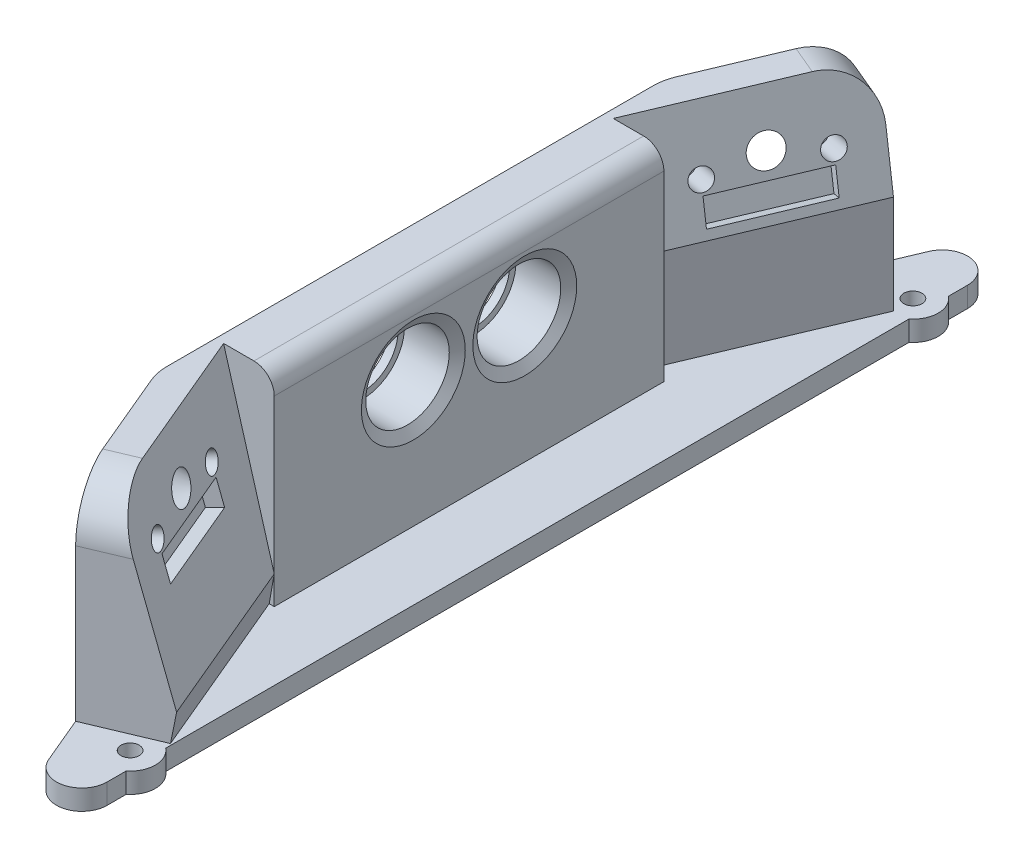
from build123d import *

# Parameters (mm, degrees)
SKETCH_4_R               = 1.7999999999999927
EXTRUDE_1_DEPTH          = 4
EXTRUDE_2_DEPTH          = 40
SKETCH_6_W               = 76.91060849654107
SKETCH_6_H               = 40
EXTRUDE_3_DEPTH          = 10
SKETCH_7_R               = 8.25
SKETCH_7_R_2             = 8.250000000000004
CUT_EXTRUDE_1_DEPTH      = 10
SKETCH_8_R               = 6.999999999999999
CUT_EXTRUDE_2_DEPTH      = 119.93776725632856
EXTRUDE_5_DEPTH          = 40
SKETCH_9_R               = 2.0000000000000115
SKETCH_9_R_2             = 2.00000000000001
CUT_EXTRUDE_3_DEPTH      = 7
CUT_EXTRUDE_5_DEPTH      = 146.2070616981638
CUT_EXTRUDE_5_DEPTH_BACK = 146.2070616981638
SKETCH_9_4_R             = 3.0000000000000018
CUT_EXTRUDE_6_DEPTH      = 2
DRAFT_2_ANGLE            = -30.000000000000068
CHAMFER_4_SIZE           = 2
CHAMFER_4_SIZE2          = 1.1547005383792546
EXTRUDE_7_DEPTH          = 40
FILLET_5_R               = 5
SKETCH_14_R              = 1.9999999999999967
CUT_EXTRUDE_8_DEPTH      = 7
SKETCH_14_7_R            = 2.9999999999999947
CUT_EXTRUDE_9_DEPTH      = 197.0223260158318
CUT_EXTRUDE_10_DEPTH     = 3
DRAFT_3_ANGLE            = -30.000000000000068
FILLET_6_R               = 10
FILLET_7_R               = 10
FILLET_8_R               = 4
EXTRUDE_START            = -4
SKETCH_15_R              = 5.000000000000005
SKETCH_15_R_2            = 1.7999999999999927
EXTRUDE_8_DEPTH          = 4


with BuildPart() as part:
    # Эскиз4 → Бобышка-Вытянуть1 (new body)
    with BuildSketch(Plane(origin=(0, 0, 0), x_dir=(1, 0, 0), z_dir=(0, 1, 0))):
        Polygon((-69.87376571346093, 109.67480643053035), (-95.00000000000003, 50), (-95.00000000000009, -50), (-69.87376571346097, -109.67480643053035), align=None)
        with Locations(Location((-73.00000000000004, 77.26, 0), (0, 0, 270))):
            Circle(SKETCH_4_R, mode=Mode.SUBTRACT)
        with Locations(Location((-73.0000000000001, -77.26, 0), (0, 0, 90))):
            Circle(SKETCH_4_R, mode=Mode.SUBTRACT)
    extrude(amount=EXTRUDE_1_DEPTH)

    # Эскиз5 → Бобышка-Вытянуть2 (add)
    with BuildSketch(Plane(origin=(0, 4, 0), x_dir=(1, 0, 0), z_dir=(0, 1, 0))):
        Polygon((-95.00000000000003, -50), (-95.00000000000003, 50), (-83.35828999825604, 77.64906125414197), (-77.82847774742764, 75.32071925379316), (-93.35075774975296, 38.45530424827052), (-93.35075774975294, -38.45530424827055), (-77.82847774742763, -75.32071925379319), (-83.35828999825621, -77.64906125414207), align=None)
    extrude(amount=EXTRUDE_2_DEPTH)

    # Эскиз6 → Бобышка-Вытянуть3 (add)
    with BuildSketch(Plane(origin=(-93.35075774975296, 0, 1.684e-14), x_dir=(-1.5e-16, 0, -1), z_dir=(1, 0, -1.5e-16))):
        with Locations((0, 24)):
            Rectangle(SKETCH_6_W, SKETCH_6_H)
    extrude(amount=EXTRUDE_3_DEPTH)

    # Эскиз7 → Вырез-Вытянуть1 (cut)
    with BuildSketch(Plane(origin=(-83.35075774975297, 0, 0), x_dir=(-2.9e-16, 0, -1), z_dir=(1, 0, -2.9e-16))):
        with Locations((-11, 28.999999999999996)):
            Circle(SKETCH_7_R)
        with Locations(Location((11, 28.999999999999996, 0), (0, 0, 180))):
            Circle(SKETCH_7_R_2)
    extrude(amount=-CUT_EXTRUDE_1_DEPTH, mode=Mode.SUBTRACT)

    # Эскиз8 → Вырез-Вытянуть2 (cut, through all)
    with BuildSketch(Plane(origin=(-83.35075774975297, 0, 0), x_dir=(-2.9e-16, 0, -1), z_dir=(1, 0, -2.9e-16))):
        with Locations((-11, 28.999999999999996)):
            Circle(SKETCH_8_R)
        with Locations((11, 28.999999999999996)):
            Circle(SKETCH_8_R)
    extrude(amount=-CUT_EXTRUDE_2_DEPTH, mode=Mode.SUBTRACT)

    # Эскиз11 → Бобышка-Вытянуть5 (add)
    with BuildSketch(Plane(origin=(15.21818058997927, 0, -36.143178901200706), x_dir=(-0.921635375138065, 0, -0.3880570000581333), z_dir=(0.3880570000581333, 0, -0.921635375138065))):
        Polygon((100.95821064102289, 44), (100.95821064102287, 4), (95.46066620957018, 4), (95.46066620957018, 23.48288486495062), align=None)
    extrude(amount=-EXTRUDE_5_DEPTH)

    # Эскиз9 → Вырез-Вытянуть3 (cut)
    with BuildSketch(Plane(origin=(-85.21572151642773, 1.219544691400093, -28.236570194978846), x_dir=(0.4235830207630388, -0.16773125949651355, -0.8901930403620174), z_dir=(0.8902314112674724, 0.2588190451025148, 0.3748342784284101))):
        with Locations(Location((12.376634231225777, 34.970039830268206, 0), (0, 0, 10))):
            Circle(SKETCH_9_R)
        with Locations(Location((32.07278929146997, 38.443003383606666, 0), (0, 0, 10))):
            Circle(SKETCH_9_R_2)
    extrude(amount=-CUT_EXTRUDE_3_DEPTH, mode=Mode.SUBTRACT)

    # Эскиз9<4> → Вырез-Вытянуть5 (cut, two sides: drawn at the far end of the back side and taken through both)
    with BuildSketch(Plane(origin=(-85.21572151642773, 1.219544691400093, -28.236570194978846), x_dir=(0.4235830207630388, -0.16773125949651355, -0.8901930403620174), z_dir=(0.8902314112674724, 0.2588190451025148, 0.3748342784284101)).offset(-CUT_EXTRUDE_5_DEPTH_BACK)):
        with Locations(Location((21.877415406014027, 38.67613711296185, 0), (0, 0, 10))):
            Circle(SKETCH_9_4_R)
    extrude(amount=CUT_EXTRUDE_5_DEPTH + CUT_EXTRUDE_5_DEPTH_BACK, mode=Mode.SUBTRACT)

    # Эскиз9<5> → Вырез-Вытянуть6 (cut)
    with BuildSketch(Plane(origin=(-85.21572151642773, 1.219544691400093, -28.236570194978846), x_dir=(0.4235830207630388, -0.16773125949651355, -0.8901930403620174), z_dir=(0.8902314112674724, 0.2588190451025148, 0.3748342784284101))):
        Polygon((32.50690973563728, 35.98098400107614), (33.37515062397189, 31.056945236015093), (13.678995563727707, 27.583981682676626), (12.810754675393087, 32.50802044773767), align=None)
    extrude(amount=-CUT_EXTRUDE_6_DEPTH, mode=Mode.SUBTRACT)

    # Уклон2
    draft_2_faces = [part.faces().sort_by_distance(p)[0] for p in [
        (-87.94135808343135, 33.07633198077402, -56.79319041159188),
    ]]
    draft(draft_2_faces, Plane(origin=(-88.28402632533289, 23.48288486495062, -36.32194364851473), x_dir=(-0.38805700005813326, 0, 0.921635375138065), z_dir=(0.8902314112674724, 0.25881904510251486, 0.3748342784284101)), DRAFT_2_ANGLE)

    # Фаска4
    chamfer_4_edges = [part.edges().sort_by_distance(p)[0] for p in [
        (-83.35075774975297, 28.999999999999996, 19.25),
        (-83.35075774975297, 28.999999999999993, -19.250000000000004),
    ]]
    chamfer_4_side = [part.faces().sort_by_distance(p)[0] for p in [
        (-83.35075774975296, 23.192741373787275, 1.985e-14),
    ]]
    chamfer(chamfer_4_edges, length=CHAMFER_4_SIZE, length2=CHAMFER_4_SIZE2, reference=chamfer_4_side[0])

    # Эскиз13 → Бобышка-Вытянуть7 (add)
    with BuildSketch(Plane(origin=(15.218180589979285, 0, 36.14317890120071), x_dir=(0.9216353751380649, 0, -0.3880570000581336), z_dir=(0.3880570000581336, 0, 0.9216353751380649))):
        Polygon((-100.95821064102287, 4), (-92.66349226478029, 4), (-91.74185688964222, 9.604099539318526), (-100.95821064102287, 44), align=None)
    extrude(amount=-EXTRUDE_7_DEPTH)

    # Скругление5
    fillet_5_edges = [part.edges().sort_by_distance(p)[0] for p in [
        (-69.87376571346097, 2, 109.67480643053035),
        (-69.87376571346093, 2, -109.67480643053035),
    ]]
    fillet(fillet_5_edges, radius=FILLET_5_R)

    # Эскиз14 → Вырез-Вытянуть8 (cut)
    with BuildSketch(Plane(origin=(-130.37952918413438, -11.588940751898866, -87.87159470486353), x_dir=(-0.16922921771030944, -0.5760706481829773, -0.7996899900431423), z_dir=(0.8902314112674723, 0.2588190451025148, -0.37483427842841044))):
        with Locations(Location((-157.84133840427307, -60.52803491764942, 0), (0, 0, 36.611944089))):
            Circle(SKETCH_14_R)
        with Locations(Location((-141.78747507398478, -48.60019051170477, 0), (0, 0, 36.611944089))):
            Circle(SKETCH_14_R)
    extrude(amount=-CUT_EXTRUDE_8_DEPTH, mode=Mode.SUBTRACT)

    # Эскиз14<7> → Вырез-Вытянуть9 (cut, through all)
    with BuildSketch(Plane(origin=(-130.37952918413438, -11.588940751898866, -87.87159470486353), x_dir=(-0.16922921771030944, -0.5760706481829773, -0.7996899900431423), z_dir=(0.8902314112674723, 0.2588190451025148, -0.37483427842841044))):
        with Locations(Location((-151.00719117972338, -52.95872638164829, 0), (0, 0, 36.611944089))):
            Circle(SKETCH_14_7_R)
    extrude(amount=-CUT_EXTRUDE_9_DEPTH, mode=Mode.SUBTRACT)

    # Эскиз14<8> → Вырез-Вытянуть10 (cut)
    with BuildSketch(Plane(origin=(-130.37952918413438, -11.588940751898866, -87.87159470486353), x_dir=(-0.16922921771030944, -0.5760706481829773, -0.7996899900431423), z_dir=(0.8902314112674723, 0.2588190451025148, -0.37483427842841044))):
        Polygon((-140.29649452324173, -50.60692342799085), (-137.31453342175553, -54.62038926056291), (-153.36839675204382, -66.54823366650756), (-156.35035785353, -62.5347678339355), align=None)
    extrude(amount=-CUT_EXTRUDE_10_DEPTH, mode=Mode.SUBTRACT)

    # Уклон3
    draft_3_faces = [part.faces().sort_by_distance(p)[0] for p in [
        (-85.61301608307252, 33.07633198078981, 62.32300266241607),
    ]]
    draft(draft_3_faces, Plane(origin=(-84.85664010269413, 9.604099539318526, 34.878833660035305), x_dir=(0.3880570000581336, 0, 0.9216353751380649), z_dir=(0.8902314112674723, 0.25881904510251463, -0.3748342784284104)), DRAFT_3_ANGLE)

    # Скругление6
    fillet_6_edges = [part.edges().sort_by_distance(p)[0] for p in [
        (-95.00000000000006, 22, 50),
        (-95.00000000000003, 22, -50),
    ]]
    fillet(fillet_6_edges, radius=FILLET_6_R)

    # Скругление7
    fillet_7_edges = [part.edges().sort_by_distance(p)[0] for p in [
        (-80.59338387284191, 44, 76.48489025396762),
        (-80.59338387284184, 44, -76.48489025396756),
    ]]
    fillet(fillet_7_edges, radius=FILLET_7_R)

    # Скругление8
    fillet_8_edges = [part.edges().sort_by_distance(p)[0] for p in [
        (-83.35075774975296, 44, 1.539e-14),
    ]]
    fillet(fillet_8_edges, radius=FILLET_8_R)

    # Эскиз15 → Бобышка-Вытянуть8 (add)
    # profile 1 of 2: a face of its own
    with BuildSketch(Plane(origin=(0, 4, 0), x_dir=(1, 0, 0), z_dir=(0, 1, 0)).offset(EXTRUDE_START)):
        with Locations((-73.00000000000004, 77.26)):
            Circle(SKETCH_15_R)
        with Locations(Location((-73.00000000000004, 77.26, 0), (0, 0, 270))):
            Circle(SKETCH_15_R_2, mode=Mode.SUBTRACT)
    # profile 2 of 2: a face of its own
    with BuildSketch(Plane(origin=(0, 4, 0), x_dir=(1, 0, 0), z_dir=(0, 1, 0)).offset(EXTRUDE_START)):
        with Locations((-73.00000000000004, -77.26)):
            Circle(SKETCH_15_R)
        with Locations(Location((-73.00000000000004, -77.26, 0), (0, 0, 90))):
            Circle(SKETCH_15_R_2, mode=Mode.SUBTRACT)
    extrude(amount=EXTRUDE_8_DEPTH)


solid = part.part
